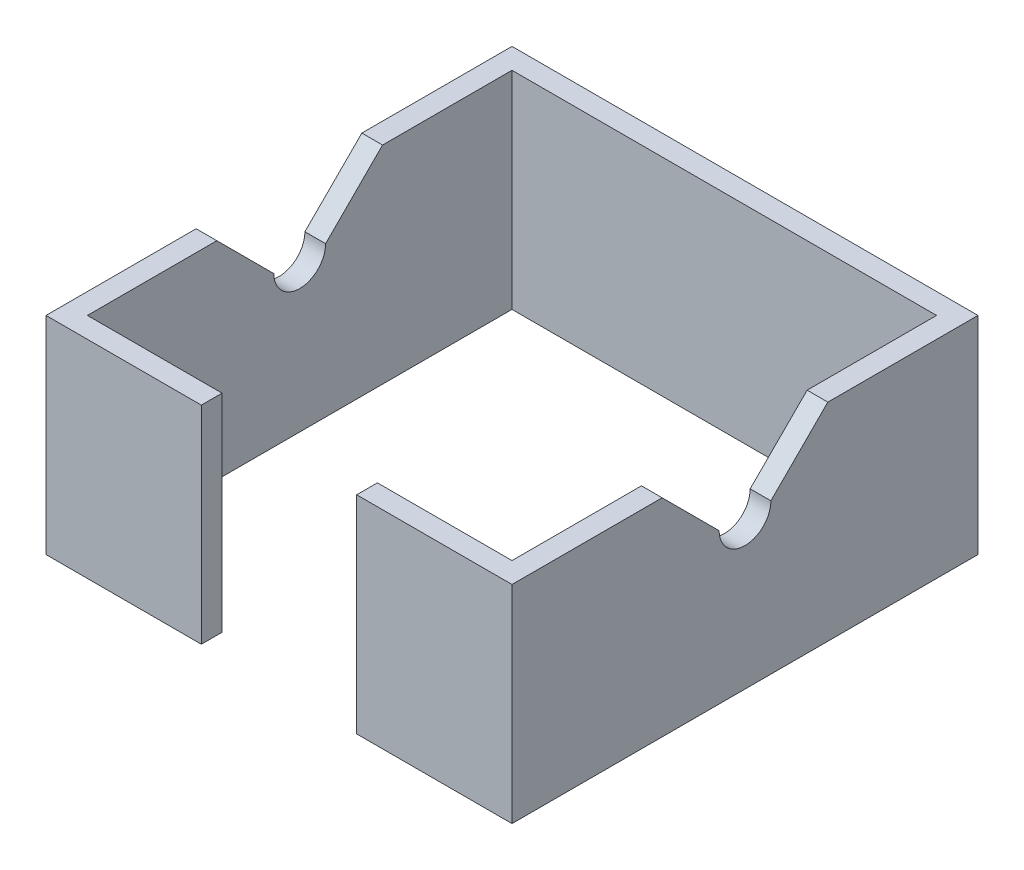
from build123d import *

# Parameters (mm, degrees)
SKICA1_W                      = 45
SKICA1_H                      = 45
SKICA1_W_2                    = 41
SKICA1_H_2                    = 41
P_IDAT_VYSUNUT_M1_DEPTH       = 20
ODEBRAT_VYSUNUT_M1_REACH      = 68.708
SKICA2_W                      = 15
SKICA2_H                      = 20
ODEBRAT_VYSUNUT_M2_DEPTH      = 67.708320321
ODEBRAT_VYSUNUT_M2_DEPTH_BACK = 67.708320321


with BuildPart() as part:
    # Skica1 → Přidat vysunutím1 (new body)
    with BuildSketch(Plane(origin=(0, 0, 0), x_dir=(1, 0, 0), z_dir=(0, 1, 0))):
        with Locations((22.5, -22.5)):
            Rectangle(SKICA1_W, SKICA1_H)
        with Locations((22.5, -22.5)):
            Rectangle(SKICA1_W_2, SKICA1_H_2, mode=Mode.SUBTRACT)
    extrude(amount=P_IDAT_VYSUNUT_M1_DEPTH)

    # Skica2 → Odebrat vysunutím1 (cut, up to next)
    with BuildSketch(Plane.XY.offset(45), mode=Mode.PRIVATE) as odebrat_vysunut_m1_sk1:
        with Locations((22.5, 10)):
            Rectangle(SKICA2_W, SKICA2_H)
    odebrat_vysunut_m1_tool1 = extrude(odebrat_vysunut_m1_sk1.sketch, amount=-ODEBRAT_VYSUNUT_M1_REACH, mode=Mode.PRIVATE) & part.part
    add(odebrat_vysunut_m1_tool1.solids().sort_by_distance((22.5, 10, 45))[0], mode=Mode.SUBTRACT)

    # Skica3 → Odebrat vysunutím2 (cut, two sides: drawn at the far end of the back side and taken through both)
    with BuildSketch(Plane.ZY.offset(-ODEBRAT_VYSUNUT_M2_DEPTH_BACK)):
        with BuildLine():
            ThreePointArc((25, 14.5), (24.267766953, 16.267766953), (22.5, 17))
            Line((22.5, 17), (22.5, 14.5))
            Line((22.5, 14.5), (25, 14.5))
        make_face()
        with BuildLine():
            Line((22.5, 14.5), (22.5, 17))
            ThreePointArc((22.5, 17), (20.732233047, 16.267766953), (20, 14.5))
            Line((20, 14.5), (22.5, 14.5))
        make_face()
        with BuildLine():
            Line((25, 14.5), (22.5, 14.5))
            Line((22.5, 14.5), (22.5, 12))
            ThreePointArc((22.5, 12), (24.267766953, 12.732233047), (25, 14.5))
        make_face()
        with BuildLine():
            Line((22.5, 12), (22.5, 14.5))
            Line((22.5, 14.5), (20, 14.5))
            ThreePointArc((20, 14.5), (20.732233047, 12.732233047), (22.5, 12))
        make_face()
        with BuildLine():
            Line((30.5, 20), (22.5, 20))
            Line((22.5, 20), (22.5, 17))
            ThreePointArc((22.5, 17), (24.267766953, 16.267766953), (25, 14.5))
            Line((25, 14.5), (30.5, 20))
        make_face()
        with BuildLine():
            Line((22.5, 17), (22.5, 20))
            Line((22.5, 20), (14.5, 20))
            Line((14.5, 20), (20, 14.5))
            ThreePointArc((20, 14.5), (20.732233047, 16.267766953), (22.5, 17))
        make_face()
    extrude(amount=ODEBRAT_VYSUNUT_M2_DEPTH + ODEBRAT_VYSUNUT_M2_DEPTH_BACK, mode=Mode.SUBTRACT)


solid = part.part
